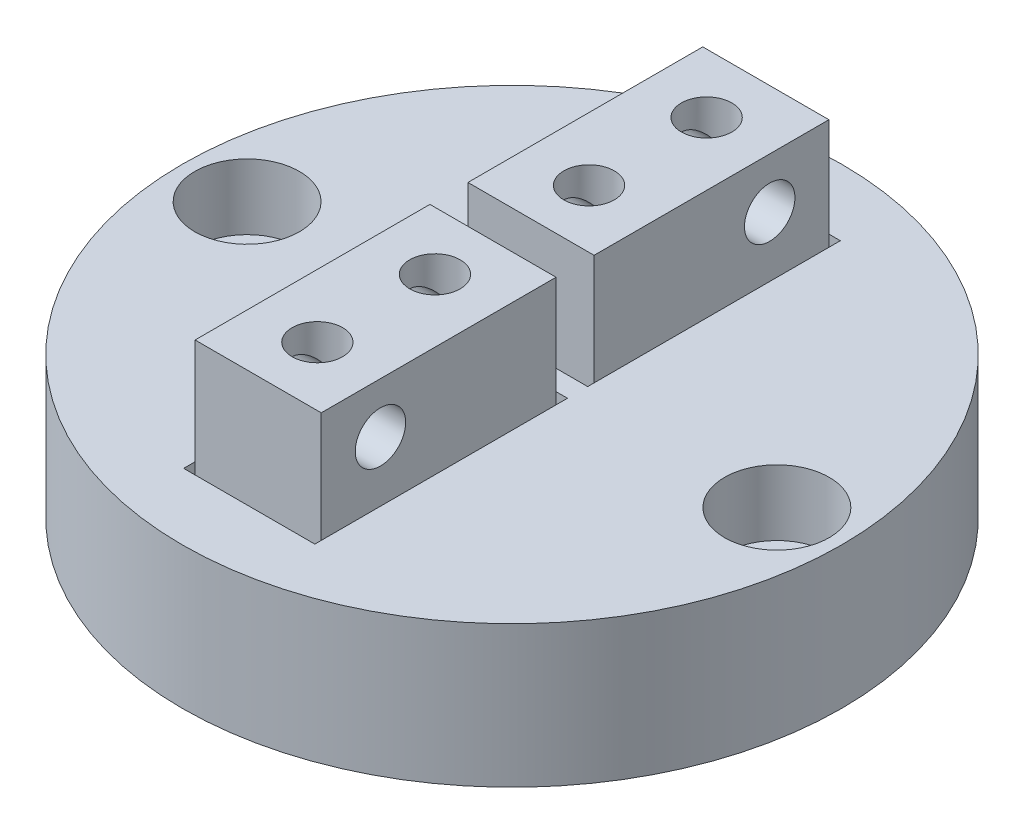
from build123d import *

# Parameters (mm, degrees)
SKETCH1_R                                           = 24.892
BOSS_EXTRUDE1_DEPTH                                 = 10.6934
CBORE_FOR_4_BINDING_HEAD_MACHINE_SCREW1_D           = 5.969
CBORE_FOR_4_BINDING_HEAD_MACHINE_SCREW1_CBORE_D     = 9.652
CBORE_FOR_4_BINDING_HEAD_MACHINE_SCREW1_CBORE_DEPTH = 4.2164
CBORE_FOR_4_BINDING_HEAD_MACHINE_SCREW2_D           = 5.3848
CBORE_FOR_4_BINDING_HEAD_MACHINE_SCREW2_CBORE_D     = 7.8994
CBORE_FOR_4_BINDING_HEAD_MACHINE_SCREW2_CBORE_DEPTH = 4.953
SKETCH6_R                                           = 2.1971
CUT_EXTRUDE1_DEPTH                                  = 37.790924581
SKETCH7_W                                           = 9.906
SKETCH7_H                                           = 19.0754
CUT_EXTRUDE2_DEPTH                                  = 1.3716
SKETCH8_W                                           = 9.525
SKETCH8_H                                           = 17.7292
BOSS_EXTRUDE2_DEPTH                                 = 9.525
SKETCH9_R                                           = 0.9144
CUT_EXTRUDE3_DEPTH                                  = 6.7
SKETCH10_R                                          = 0.6985
CUT_EXTRUDE11_DEPTH                                 = 37.790924581
SKETCH11_R                                          = 1.905
CUT_EXTRUDE12_DEPTH                                 = 40.930254172
CUT_EXTRUDE13_REACH                                 = 45.06
CUT_EXTRUDE13_END_RADIUS                            = 1.905
SKETCH12_R                                          = 1.905
SKETCH13_R                                          = 1.905
CUT_EXTRUDE14_DEPTH                                 = 44.06045639


with BuildPart() as part:
    # Sketch1 → Boss-Extrude1 (new body)
    with BuildSketch(Plane(origin=(0, 0, 0), x_dir=(1, 0, 0), z_dir=(0, 1, 0))):
        with Locations(Location((0, 0, 0), (0, 0, 90))):
            Circle(SKETCH1_R)
    extrude(amount=BOSS_EXTRUDE1_DEPTH)

    # CBORE for #4 Binding Head Machine Screw1 (through all)
    with Locations(Plane(origin=(0, 0, 0), x_dir=(-1, 0, 0), z_dir=(0, -1, 0))):
        with Locations((0, -14.6939), (0, 14.6939)):
            CounterBoreHole(CBORE_FOR_4_BINDING_HEAD_MACHINE_SCREW1_D / 2, CBORE_FOR_4_BINDING_HEAD_MACHINE_SCREW1_CBORE_D / 2, CBORE_FOR_4_BINDING_HEAD_MACHINE_SCREW1_CBORE_DEPTH)

    # CBORE for #4 Binding Head Machine Screw2 (through all)
    with Locations(Plane(origin=(0, 10.6934, 0), x_dir=(1, 0, 0), z_dir=(0, 1, 0))):
        with Locations((-20, 0), (20, 0)):
            CounterBoreHole(CBORE_FOR_4_BINDING_HEAD_MACHINE_SCREW2_D / 2, CBORE_FOR_4_BINDING_HEAD_MACHINE_SCREW2_CBORE_D / 2, CBORE_FOR_4_BINDING_HEAD_MACHINE_SCREW2_CBORE_DEPTH)

    # Sketch6 → Cut-Extrude1 (cut, through all)
    with BuildSketch(Plane(origin=(0, 0, 0), x_dir=(1, 0, 0), z_dir=(0, 1, 0))):
        with Locations(Location((0, -5.8166, 0), (0, 0, 90))):
            Circle(SKETCH6_R)
        with Locations(Location((0, 5.8166, 0), (0, 0, 90))):
            Circle(SKETCH6_R)
    extrude(amount=CUT_EXTRUDE1_DEPTH, mode=Mode.SUBTRACT)

    # Sketch7 → Cut-Extrude2 (cut)
    with BuildSketch(Plane(origin=(0, 10.6934, 0), x_dir=(1, 0, 0), z_dir=(0, 1, 0))):
        with Locations((0, 10.2997)):
            Rectangle(SKETCH7_W, SKETCH7_H)
    cut_extrude2 = extrude(amount=-CUT_EXTRUDE2_DEPTH, mode=Mode.SUBTRACT)

    # Mirror1: Cut-Extrude2 across plane
    add(cut_extrude2.mirror(Plane.XY), mode=Mode.SUBTRACT)

    # Sketch9 → Cut-Extrude3 (cut)
    with BuildSketch(Plane(origin=(0, 0, 0), x_dir=(1, 0, 0), z_dir=(0, 1, 0))):
        with Locations(Location((0, 0, 0), (0, 0, 270))):
            Circle(SKETCH9_R)
    extrude(amount=CUT_EXTRUDE3_DEPTH, mode=Mode.SUBTRACT)

    # Sketch10 → Cut-Extrude11 (cut, through all)
    with BuildSketch(Plane(origin=(0, 10.6934, 0), x_dir=(1, 0, 0), z_dir=(0, 1, 0))):
        with Locations(Location((0, 0, 0), (0, 0, 270))):
            Circle(SKETCH10_R)
    extrude(amount=-CUT_EXTRUDE11_DEPTH, mode=Mode.SUBTRACT)


with BuildPart() as body_2:
    # Sketch8 → Boss-Extrude2 (new body)
    with BuildSketch(Plane(origin=(0, 9.3218, 0), x_dir=(1, 0, 0), z_dir=(0, 1, 0))):
        with Locations((0, 10.2997)):
            Rectangle(SKETCH8_W, SKETCH8_H)
    extrude(amount=BOSS_EXTRUDE2_DEPTH)

    # Sketch11 → Cut-Extrude12 (cut, through all)
    with BuildSketch(Plane(origin=(0, 18.8468, 0), x_dir=(1, 0, 0), z_dir=(0, 1, 0))):
        with Locations(Location((0, 14.6939, 0), (0, 0, 270))):
            Circle(SKETCH11_R)
        with Locations(Location((0, 5.8166, 0), (0, 0, 270))):
            Circle(SKETCH11_R)
    extrude(amount=-CUT_EXTRUDE12_DEPTH, mode=Mode.SUBTRACT)

    # Cut-Extrude13: up to this cylinder (the profile starts outside it)
    cut_extrude13_end = Plane(origin=(0, 15.0368, -5.8166), z_dir=(0, 1, 0)) * Cylinder(CUT_EXTRUDE13_END_RADIUS, 94.93, mode=Mode.PRIVATE)
    # Sketch12 → Cut-Extrude13 (cut, up to the surface)
    with BuildSketch(Plane.ZY.offset(4.7625), mode=Mode.PRIVATE) as cut_extrude13_sk1:
        with Locations((-5.8166, 15.0368)):
            Circle(SKETCH12_R)
    cut_extrude13_tool1 = extrude(cut_extrude13_sk1.sketch, amount=-CUT_EXTRUDE13_REACH, mode=Mode.PRIVATE) - cut_extrude13_end
    add(cut_extrude13_tool1.solids().sort_by_distance((-4.7625, 15.0368, -5.8166))[0], mode=Mode.SUBTRACT)

    # Sketch13 → Cut-Extrude14 (cut, through all)
    with BuildSketch(Plane.ZY.offset(4.7625)):
        with Locations((-14.6939, 15.0368)):
            Circle(SKETCH13_R)
    extrude(amount=-CUT_EXTRUDE14_DEPTH, mode=Mode.SUBTRACT)


with BuildPart() as body_3:
    # Mirror2: mirrored copy
    add(body_2.part.mirror(Plane.XY))


solid = Compound([part.part, body_2.part, body_3.part])
